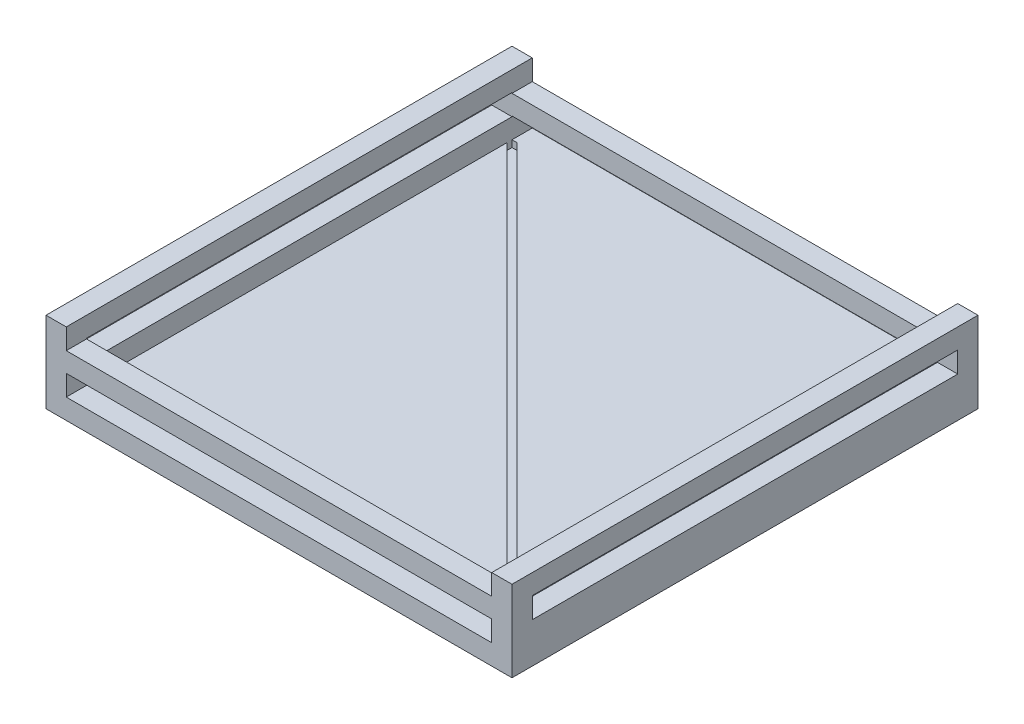
from build123d import *

# Parameters (mm, degrees)
SKETCH1_W          = 115
SKETCH1_H          = 115
BASE_DEPTH         = 5
SKETCH2_W          = 115
SKETCH2_H          = 15
SKETCH2_W_2        = 105
SKETCH2_H_2        = 5.16
FRAME1_DEPTH       = 5
FRAME2_START       = -5
FRAME2_DEPTH       = 5
FRAME3_START       = -110
SKETCH2_4_W        = 115
SKETCH2_4_H        = 15
SKETCH2_4_W_2      = 105
SKETCH2_4_H_2      = 5.16
FRAME3_DEPTH       = 5
FRAME4_START       = -110
FRAME4_DEPTH       = 5
ANGLED_TRACK_DEPTH = 1.67


with BuildPart() as part:
    # Sketch1 → Base (new body)
    with BuildSketch(Plane(origin=(0, 0, 0), x_dir=(1, 0, 0), z_dir=(0, 1, 0))):
        Rectangle(SKETCH1_W, SKETCH1_H)
    extrude(amount=BASE_DEPTH)

    # Sketch2 → Frame1 (add)
    with BuildSketch(Plane.ZY.offset(57.5)):
        with Locations((0, 12.5)):
            Rectangle(SKETCH2_W, SKETCH2_H)
        with Locations((0, 12.5)):
            Rectangle(SKETCH2_W_2, SKETCH2_H_2, mode=Mode.SUBTRACT)
    extrude(amount=-FRAME1_DEPTH)

    # Sketch4 → Frame2 (add)
    with BuildSketch(Plane(origin=(0, 0, -57.5), x_dir=(-1, 0, 0), z_dir=(0, 0, -1)).offset(FRAME2_START)):
        Polygon((-57.5, 5), (-52.5, 5), (-52.5, 10.08), (52.5, 10.08), (52.5, 5), (57.5, 5), (57.5, 20), (52.5, 20), (52.5, 14.92), (-52.5, 14.92), (-52.5, 20), (-57.5, 20), align=None)
    extrude(amount=FRAME2_DEPTH)

    # Sketch2<4> → Frame3 (add)
    with BuildSketch(Plane.ZY.offset(57.5).offset(FRAME3_START)):
        with Locations((0, 12.5)):
            Rectangle(SKETCH2_4_W, SKETCH2_4_H)
        with Locations((0, 12.5)):
            Rectangle(SKETCH2_4_W_2, SKETCH2_4_H_2, mode=Mode.SUBTRACT)
    extrude(amount=-FRAME3_DEPTH)

    # Sketch4<3> → Frame4 (add)
    with BuildSketch(Plane(origin=(0, 0, -57.5), x_dir=(-1, 0, 0), z_dir=(0, 0, -1)).offset(FRAME4_START)):
        Polygon((-57.5, 5), (-52.5, 5), (-52.5, 10.08), (52.5, 10.08), (52.5, 5), (57.5, 5), (57.5, 20), (52.5, 20), (52.5, 14.92), (-52.5, 14.92), (-52.5, 20), (-57.5, 20), align=None)
    extrude(amount=-FRAME4_DEPTH)

    # Sketch7 → Angled Track (cut)
    with BuildSketch(Plane(origin=(0, 5, 0), x_dir=(1, 0, 0), z_dir=(0, 1, 0))):
        Polygon((52.5, -51.264920156), (-51.264920156, 52.5), (-52.5, 52.5), (-52.5, 51.264920156), (51.264920156, -52.5), (52.5, -52.5), align=None)
    extrude(amount=-ANGLED_TRACK_DEPTH, mode=Mode.SUBTRACT)


solid = part.part
